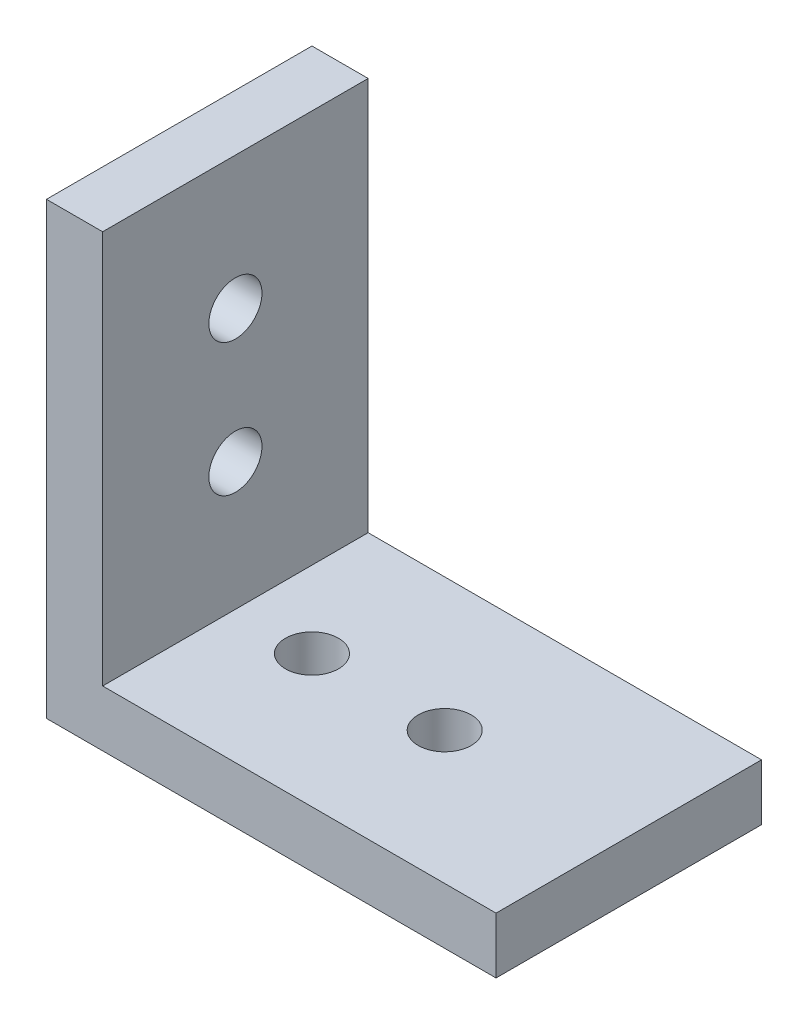
from build123d import *

# Parameters (mm, degrees)
SKETCH1_W           = 15
SKETCH1_H           = 25.4
BOSS_EXTRUDE1_DEPTH = 3.175
SKETCH2_W           = 15
SKETCH2_H           = 3.175
BOSS_EXTRUDE2_DEPTH = 22.225
SKETCH3_R           = 1.5
CUT_EXTRUDE2_DEPTH  = 39.927111375
SKETCH4_R           = 1.5
CUT_EXTRUDE3_DEPTH  = 37.933868265


with BuildPart() as part:
    # Sketch1 → Boss-Extrude1 (new body)
    with BuildSketch(Plane(origin=(0, 0, 0), x_dir=(0, 0, -1), z_dir=(1, 0, 0))):
        with Locations((7.5, 12.7)):
            Rectangle(SKETCH1_W, SKETCH1_H)
    extrude(amount=BOSS_EXTRUDE1_DEPTH)

    # Sketch2 → Boss-Extrude2 (add)
    with BuildSketch(Plane(origin=(3.175, 0, 0), x_dir=(0, 0, -1), z_dir=(1, 0, 0))):
        with Locations((7.5, 1.5875)):
            Rectangle(SKETCH2_W, SKETCH2_H)
    extrude(amount=BOSS_EXTRUDE2_DEPTH)

    # Sketch3 → Cut-Extrude2 (cut, through all)
    with BuildSketch(Plane.XZ):
        with Locations(Location((7.5, -7.5, 0), (0, 0, 270))):
            Circle(SKETCH3_R)
        with Locations(Location((15, -7.5, 0), (0, 0, 270))):
            Circle(SKETCH3_R)
    extrude(amount=-CUT_EXTRUDE2_DEPTH, mode=Mode.SUBTRACT)

    # Sketch4 → Cut-Extrude3 (cut, through all)
    with BuildSketch(Plane(origin=(3.175, 0, 0), x_dir=(0, 0, -1), z_dir=(1, 0, 0))):
        with Locations((7.5, 17.9)):
            Circle(SKETCH4_R)
        with Locations((7.5, 10.4)):
            Circle(SKETCH4_R)
    extrude(amount=-CUT_EXTRUDE3_DEPTH, mode=Mode.SUBTRACT)


solid = part.part
